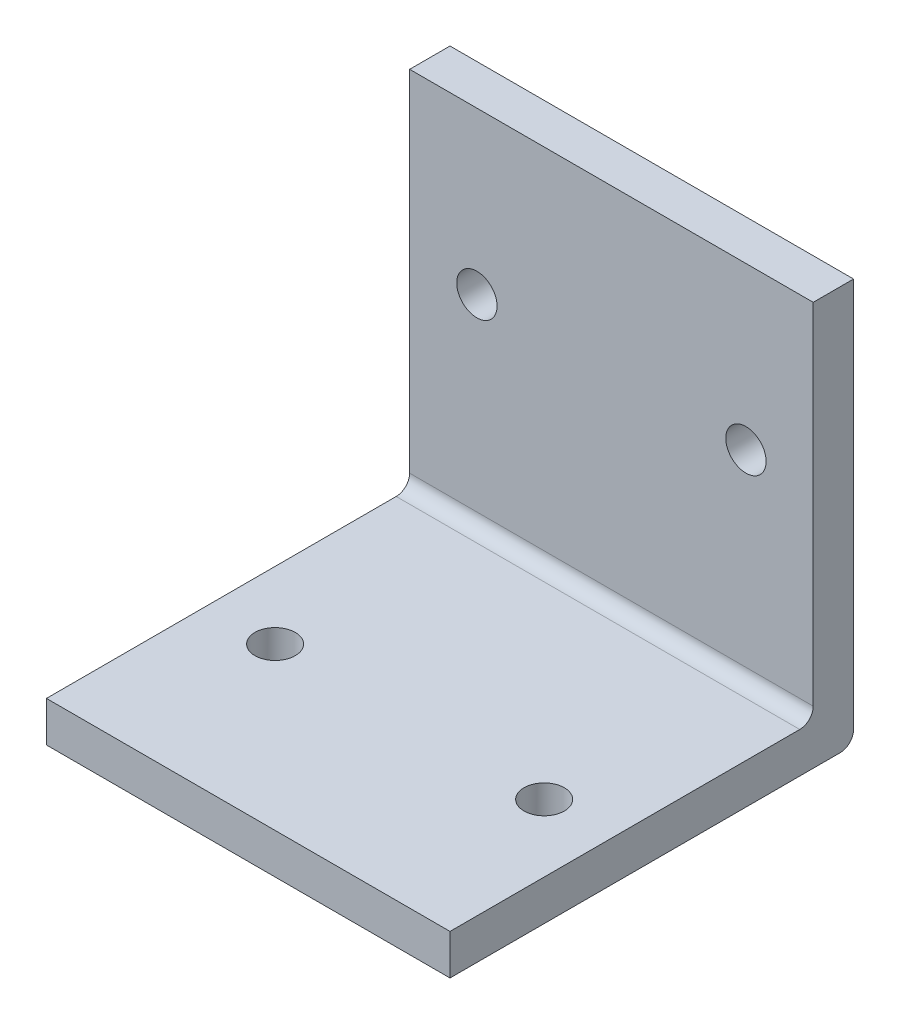
from build123d import *

# Parameters (mm, degrees)
SKETCH_1_W          = 30
SKETCH_1_H          = 30
EXTRUDE_1_DEPTH     = 3
SKETCH_2_R          = 1.5
CUT_EXTRUDE_1_DEPTH = 3.5
SKETCH_3_W          = 30
SKETCH_3_H          = 3
EXTRUDE_2_DEPTH     = 27
SKETCH_4_R          = 1.5
CUT_EXTRUDE_2_DEPTH = 27
FILLET_1_R          = 1
FILLET_2_R          = 1


with BuildPart() as part:
    # 草图1 → 凸台-拉伸1 (new body)
    with BuildSketch(Plane.XY):
        Rectangle(SKETCH_1_W, SKETCH_1_H)
    extrude(amount=EXTRUDE_1_DEPTH)

    # 草图2 → 切除-拉伸1 (cut)
    with BuildSketch(Plane.XY.offset(3)):
        with Locations((10, 3)):
            Circle(SKETCH_2_R)
        with Locations((-10, 3)):
            Circle(SKETCH_2_R)
    extrude(amount=-CUT_EXTRUDE_1_DEPTH, mode=Mode.SUBTRACT)

    # 草图3 → 凸台-拉伸2 (add)
    with BuildSketch(Plane.XY.offset(3)):
        with Locations((0, -13.5)):
            Rectangle(SKETCH_3_W, SKETCH_3_H)
    extrude(amount=EXTRUDE_2_DEPTH)

    # 草图4 → 切除-拉伸2 (cut)
    with BuildSketch(Plane(origin=(0, -12, 0), x_dir=(1, 0, 0), z_dir=(0, 1, 0))):
        with Locations(Location((10, -18, 0), (0, 0, 270))):
            Circle(SKETCH_4_R)
        with Locations(Location((-10, -18, 0), (0, 0, 270))):
            Circle(SKETCH_4_R)
    extrude(amount=-CUT_EXTRUDE_2_DEPTH, mode=Mode.SUBTRACT)

    # 圆角1
    fillet_1_edges = [part.edges().sort_by_distance(p)[0] for p in [
        (0, -12, 3),
    ]]
    fillet(fillet_1_edges, radius=FILLET_1_R)

    # 圆角2
    fillet_2_edges = [part.edges().sort_by_distance(p)[0] for p in [
        (0, -15, 0),
    ]]
    fillet(fillet_2_edges, radius=FILLET_2_R)


solid = part.part
